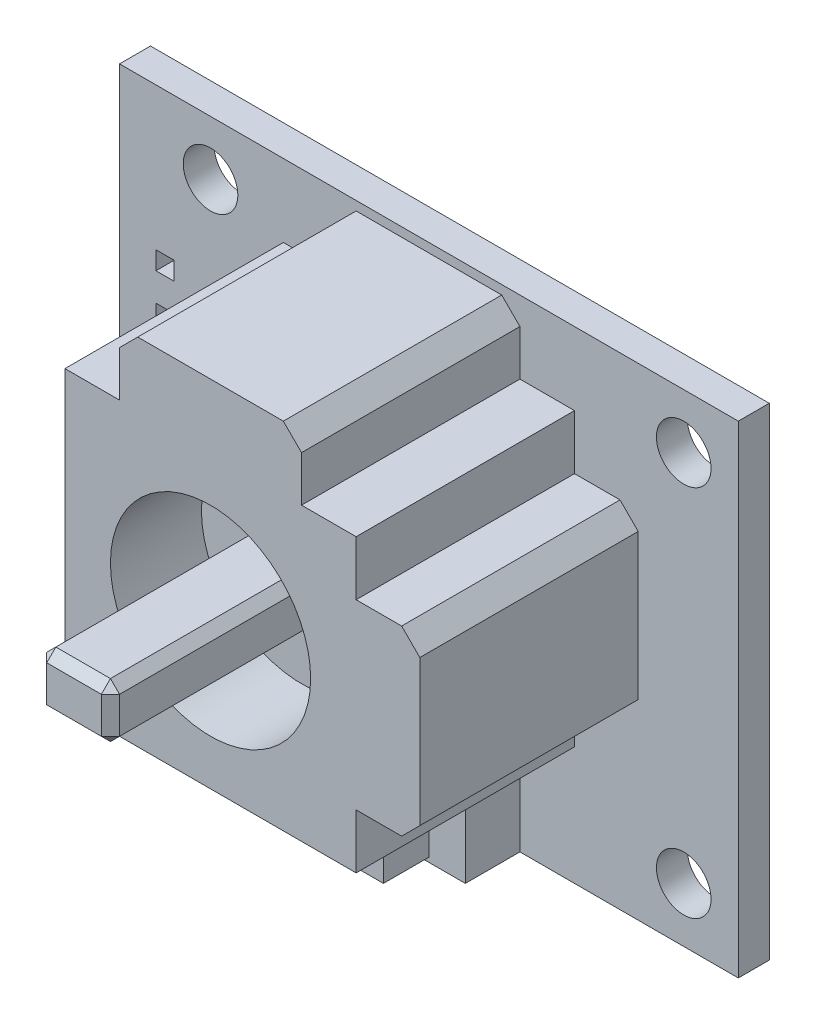
from build123d import *

# Parameters (mm, degrees)
SKETCH_1_W          = 34
SKETCH_1_H          = 26.5
EXTRUDE_1_DEPTH     = 1.7
SKETCH_2_W          = 16
SKETCH_2_H          = 16
EXTRUDE_2_DEPTH     = 12
SKETCH_3_W          = 10
SKETCH_3_H          = 6.5
EXTRUDE_3_DEPTH     = 3
SKETCH_4_W          = 6
SKETCH_4_H          = 6
EXTRUDE_4_DEPTH     = 2.5
SKETCH_5_R          = 1.553190153
EXTRUDE_5_DEPTH     = 0.5
SKETCH_6_W          = 10
SKETCH_6_H          = 3.5
SKETCH_6_W_2        = 3.5
SKETCH_6_H_2        = 10
EXTRUDE_6_DEPTH     = 12
CHAMFER_1_SIZE      = 1
SKETCH_7_R          = 5.5
CUT_EXTRUDE_1_DEPTH = 5
SKETCH_8_W          = 4
SKETCH_8_H          = 3
EXTRUDE_7_DEPTH     = 12.5
CHAMFER_2_SIZE      = 0.5
SKETCH_9_R          = 1.5
CUT_EXTRUDE_2_DEPTH = 30.065658431
SKETCH_10_W         = 1
SKETCH_10_H         = 1
CUT_EXTRUDE_3_DEPTH = 30.065658431


with BuildPart() as part:
    # Эскиз1 → Бобышка-Вытянуть1 (new body)
    with BuildSketch(Plane.XY):
        Rectangle(SKETCH_1_W, SKETCH_1_H)
    extrude(amount=EXTRUDE_1_DEPTH)

    # Эскиз2 → Бобышка-Вытянуть2 (add)
    with BuildSketch(Plane.XY.offset(1.7)):
        with Locations((0, 1.25)):
            Rectangle(SKETCH_2_W, SKETCH_2_H)
    extrude(amount=EXTRUDE_2_DEPTH)

    # Эскиз3 → Бобышка-Вытянуть3 (add)
    with BuildSketch(Plane.XY.offset(1.7)):
        with Locations((0, -10)):
            Rectangle(SKETCH_3_W, SKETCH_3_H)
    extrude(amount=EXTRUDE_3_DEPTH)

    # Эскиз4 → Бобышка-Вытянуть4 (add)
    with BuildSketch(Plane.XY.offset(4.7)):
        with Locations((0, -10)):
            Rectangle(SKETCH_4_W, SKETCH_4_H)
    extrude(amount=EXTRUDE_4_DEPTH)

    # Эскиз5 → Бобышка-Вытянуть5 (add)
    with BuildSketch(Plane.XY.offset(7.2)):
        with Locations((0, -10)):
            Circle(SKETCH_5_R)
    extrude(amount=EXTRUDE_5_DEPTH)

    # Эскиз6 → Бобышка-Вытянуть6 (add)
    with BuildSketch(Plane.XY.offset(1.7)):
        with Locations((0, 11)):
            Rectangle(SKETCH_6_W, SKETCH_6_H)
        with Locations((9.75, 1.25)):
            Rectangle(SKETCH_6_W_2, SKETCH_6_H_2)
    extrude(amount=EXTRUDE_6_DEPTH)

    # Фаска1
    chamfer_1_edges = [part.edges().sort_by_distance(p)[0] for p in [
        (5, 12.75, 7.7),
        (-5, 12.75, 7.7),
        (11.5, -3.75, 7.7),
        (11.5, 6.25, 7.7),
    ]]
    chamfer(chamfer_1_edges, length=CHAMFER_1_SIZE)

    # Эскиз7 → Вырез-Вытянуть1 (cut)
    with BuildSketch(Plane.XY.offset(13.7)):
        with Locations((0, 1.25)):
            Circle(SKETCH_7_R)
    extrude(amount=-CUT_EXTRUDE_1_DEPTH, mode=Mode.SUBTRACT)

    # Эскиз8 → Бобышка-Вытянуть7 (add)
    with BuildSketch(Plane.XY.offset(8.7)):
        with Locations((0, 1.25)):
            Rectangle(SKETCH_8_W, SKETCH_8_H)
    extrude(amount=EXTRUDE_7_DEPTH)

    # Фаска2
    chamfer_2_edges = [part.edges().sort_by_distance(p)[0] for p in [
        (2, 1.25, 8.7),
        (2, -0.25, 14.95),
        (0, 2.75, 8.7),
        (2, 2.75, 14.95),
        (-2, 1.25, 8.7),
        (-2, 2.75, 14.95),
        (0, -0.25, 8.7),
        (-2, -0.25, 14.95),
        (2, 1.25, 21.2),
        (0, 2.75, 21.2),
        (-2, 1.25, 21.2),
        (0, -0.25, 21.2),
    ]]
    chamfer(chamfer_2_edges, length=CHAMFER_2_SIZE)

    # Эскиз9 → Вырез-Вытянуть2 (cut, through all)
    with BuildSketch(Plane.XY.offset(1.7)):
        with Locations((14, 10.25)):
            Circle(SKETCH_9_R)
        with Locations((14, -10.25)):
            Circle(SKETCH_9_R)
        with Locations((-12, 10.25)):
            Circle(SKETCH_9_R)
        with Locations((-12, -10.25)):
            Circle(SKETCH_9_R)
    extrude(amount=-CUT_EXTRUDE_2_DEPTH, mode=Mode.SUBTRACT)

    # Эскиз10 → Вырез-Вытянуть3 (cut, through all)
    with BuildSketch(Plane.XY.offset(1.7)):
        with Locations((-14.5, 2.364432177)):
            Rectangle(SKETCH_10_W, SKETCH_10_H)
        with Locations((-14.5, 4.904432177)):
            Rectangle(SKETCH_10_W, SKETCH_10_H)
        with Locations((-14.5, -0.175567823)):
            Rectangle(SKETCH_10_W, SKETCH_10_H)
        with Locations((-14.5, -2.715567823)):
            Rectangle(SKETCH_10_W, SKETCH_10_H)
        with Locations((-14.5, -5.255567823)):
            Rectangle(SKETCH_10_W, SKETCH_10_H)
    extrude(amount=-CUT_EXTRUDE_3_DEPTH, mode=Mode.SUBTRACT)


solid = part.part
